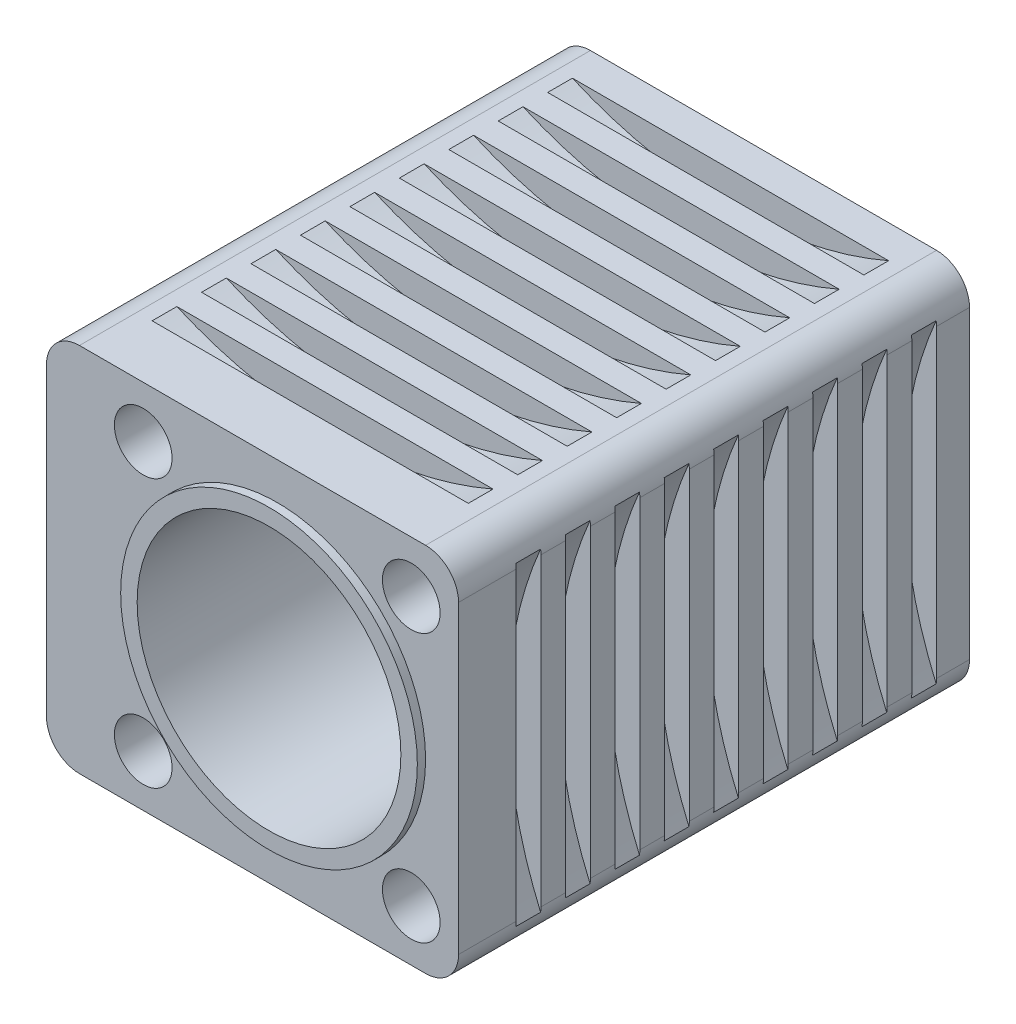
from build123d import *

# Parameters (mm, degrees)
BOSS_EXTRUDE1_DEPTH     = 31
SKETCH2_R               = 18
BOSS_EXTRUDE2_DEPTH     = 1
SKETCH3_R               = 16
CUT_EXTRUDE1_DEPTH      = 73.520686704
CUT_EXTRUDE2_DEPTH      = 2
SKETCH5_R               = 3.5
CUT_EXTRUDE3_DEPTH      = 73.520686704
SKETCH6_W               = 3
SKETCH6_H               = 48
LPATTERN2_COUNT         = 9
LPATTERN2_PITCH         = 6
MIRROR1_COPY_1_SKETCH_W = 3
MIRROR1_COPY_1_SKETCH_H = 48
MIRROR1_COPY_2_SKETCH_W = 3
MIRROR1_COPY_2_SKETCH_H = 48
MIRROR1_COPY_3_SKETCH_W = 3
MIRROR1_COPY_3_SKETCH_H = 48
MIRROR1_COPY_4_SKETCH_W = 3
MIRROR1_COPY_4_SKETCH_H = 48
MIRROR1_COPY_5_SKETCH_W = 3
MIRROR1_COPY_5_SKETCH_H = 48
MIRROR1_COPY_6_SKETCH_W = 3
MIRROR1_COPY_6_SKETCH_H = 48
MIRROR1_COPY_7_SKETCH_W = 3
MIRROR1_COPY_7_SKETCH_H = 48
MIRROR1_COPY_8_SKETCH_W = 3
MIRROR1_COPY_8_SKETCH_H = 48
SKETCH8_W               = 48
SKETCH8_H               = 3
LPATTERN3_COUNT         = 9
LPATTERN3_PITCH         = 6
MIRROR2_COPY_1_SKETCH_W = 48
MIRROR2_COPY_1_SKETCH_H = 3
MIRROR2_COPY_2_SKETCH_W = 48
MIRROR2_COPY_2_SKETCH_H = 3
MIRROR2_COPY_3_SKETCH_W = 48
MIRROR2_COPY_3_SKETCH_H = 3
MIRROR2_COPY_4_SKETCH_W = 48
MIRROR2_COPY_4_SKETCH_H = 3
MIRROR2_COPY_5_SKETCH_W = 48
MIRROR2_COPY_5_SKETCH_H = 3
MIRROR2_COPY_6_SKETCH_W = 48
MIRROR2_COPY_6_SKETCH_H = 3
MIRROR2_COPY_7_SKETCH_W = 48
MIRROR2_COPY_7_SKETCH_H = 3
MIRROR2_COPY_8_SKETCH_W = 48
MIRROR2_COPY_8_SKETCH_H = 3


with BuildPart() as part:
    # Sketch1 → Boss-Extrude1 (new, symmetric)
    with BuildSketch(Plane.XY):
        with BuildLine():
            Line((18, 22.5), (-24, 22.5))
            ThreePointArc((-24, 22.5), (-26.828427125, 21.328427125), (-28, 18.5))
            Line((-28, 18.5), (-28, -18.5))
            ThreePointArc((-28, -18.5), (-26.828427125, -21.328427125), (-24, -22.5))
            Line((-24, -22.5), (18, -22.5))
            ThreePointArc((18, -22.5), (20.828427125, -21.328427125), (22, -18.5))
            Line((22, -18.5), (22, 18.5))
            ThreePointArc((22, 18.5), (20.828427125, 21.328427125), (18, 22.5))
        make_face()
    extrude(amount=BOSS_EXTRUDE1_DEPTH, both=True)

    # Sketch2 → Boss-Extrude2 (add, symmetric)
    with BuildSketch(Plane.XY.offset(31)):
        with Locations(Location((0, 0, 0), (0, 0, 180))):
            Circle(SKETCH2_R)
    extrude(amount=BOSS_EXTRUDE2_DEPTH, both=True)

    # Sketch3 → Cut-Extrude1 (cut, through all)
    with BuildSketch(Plane.XY.offset(32)):
        Circle(SKETCH3_R)
    extrude(amount=-CUT_EXTRUDE1_DEPTH, mode=Mode.SUBTRACT)

    # Sketch4 → Cut-Extrude2 (cut)
    with BuildSketch(Plane(origin=(0, 0, -31), x_dir=(-1, 0, 0), z_dir=(0, 0, -1))):
        with BuildLine():
            Line((12.872380115, 2), (12.872380115, -2))
            Line((12.872380115, -2), (22.61, -2))
            ThreePointArc((22.61, -2), (24.657927917, -0.354015138), (23.490928495, 2))
            Line((23.490928495, 2), (12.872380115, 2))
        make_face()
    extrude(amount=-CUT_EXTRUDE2_DEPTH, mode=Mode.SUBTRACT)

    # Sketch5 → Cut-Extrude3 (cut, through all)
    with BuildSketch(Plane(origin=(0, 0, -31), x_dir=(-1, 0, 0), z_dir=(0, 0, -1))):
        with Locations((-16.263455967, 16.263455967)):
            Circle(SKETCH5_R)
        with Locations((16.263455967, 16.263455967)):
            Circle(SKETCH5_R)
        with Locations((16.263455967, -16.263455967)):
            Circle(SKETCH5_R)
        with Locations((-16.263455967, -16.263455967)):
            Circle(SKETCH5_R)
    extrude(amount=-CUT_EXTRUDE3_DEPTH, mode=Mode.SUBTRACT)

    # Sketch6 → Cut-Revolve1 (revolve, cut)
    with BuildSketch(Plane(origin=(-3, 0, 0), x_dir=(0, 0, -1), z_dir=(1, 0, 0))):
        with Locations((25.5, 42.5)):
            Rectangle(SKETCH6_W, SKETCH6_H)
    cut_revolve1 = revolve(axis=Axis((-3, 66.5, -24), (0, 0, -1)), mode=Mode.SUBTRACT)

    # LPattern2: Cut-Revolve1 ×9
    with Locations(*[(0, 0, i * LPATTERN2_PITCH) for i in range(1, LPATTERN2_COUNT)]):
        add(cut_revolve1, mode=Mode.SUBTRACT)

    # Mirror1: Cut-Revolve1 across plane
    add(cut_revolve1.mirror(Plane.ZX), mode=Mode.SUBTRACT)

    # Mirror1 copy 1 sketch → Mirror1 copy 1 (revolve, cut)
    with BuildSketch(Plane(origin=(-3, 0, 6), x_dir=(0, 0, -1), z_dir=(1, 0, 0))):
        with Locations((25.5, -42.5)):
            Rectangle(MIRROR1_COPY_1_SKETCH_W, MIRROR1_COPY_1_SKETCH_H)
    revolve(axis=Axis((-3, -66.5, -18), (0, 0, 1)), mode=Mode.SUBTRACT)

    # Mirror1 copy 2 sketch → Mirror1 copy 2 (revolve, cut)
    with BuildSketch(Plane(origin=(-3, 0, 12), x_dir=(0, 0, -1), z_dir=(1, 0, 0))):
        with Locations((25.5, -42.5)):
            Rectangle(MIRROR1_COPY_2_SKETCH_W, MIRROR1_COPY_2_SKETCH_H)
    revolve(axis=Axis((-3, -66.5, -12), (0, 0, 1)), mode=Mode.SUBTRACT)

    # Mirror1 copy 3 sketch → Mirror1 copy 3 (revolve, cut)
    with BuildSketch(Plane(origin=(-3, 0, 18), x_dir=(0, 0, -1), z_dir=(1, 0, 0))):
        with Locations((25.5, -42.5)):
            Rectangle(MIRROR1_COPY_3_SKETCH_W, MIRROR1_COPY_3_SKETCH_H)
    revolve(axis=Axis((-3, -66.5, -6), (0, 0, 1)), mode=Mode.SUBTRACT)

    # Mirror1 copy 4 sketch → Mirror1 copy 4 (revolve, cut)
    with BuildSketch(Plane(origin=(-3, 0, 24), x_dir=(0, 0, -1), z_dir=(1, 0, 0))):
        with Locations((25.5, -42.5)):
            Rectangle(MIRROR1_COPY_4_SKETCH_W, MIRROR1_COPY_4_SKETCH_H)
    revolve(axis=Axis((-3, -66.5, 0), (0, 0, 1)), mode=Mode.SUBTRACT)

    # Mirror1 copy 5 sketch → Mirror1 copy 5 (revolve, cut)
    with BuildSketch(Plane(origin=(-3, 0, 30), x_dir=(0, 0, -1), z_dir=(1, 0, 0))):
        with Locations((25.5, -42.5)):
            Rectangle(MIRROR1_COPY_5_SKETCH_W, MIRROR1_COPY_5_SKETCH_H)
    revolve(axis=Axis((-3, -66.5, 6), (0, 0, 1)), mode=Mode.SUBTRACT)

    # Mirror1 copy 6 sketch → Mirror1 copy 6 (revolve, cut)
    with BuildSketch(Plane(origin=(-3, 0, 36), x_dir=(0, 0, -1), z_dir=(1, 0, 0))):
        with Locations((25.5, -42.5)):
            Rectangle(MIRROR1_COPY_6_SKETCH_W, MIRROR1_COPY_6_SKETCH_H)
    revolve(axis=Axis((-3, -66.5, 12), (0, 0, 1)), mode=Mode.SUBTRACT)

    # Mirror1 copy 7 sketch → Mirror1 copy 7 (revolve, cut)
    with BuildSketch(Plane(origin=(-3, 0, 42), x_dir=(0, 0, -1), z_dir=(1, 0, 0))):
        with Locations((25.5, -42.5)):
            Rectangle(MIRROR1_COPY_7_SKETCH_W, MIRROR1_COPY_7_SKETCH_H)
    revolve(axis=Axis((-3, -66.5, 18), (0, 0, 1)), mode=Mode.SUBTRACT)

    # Mirror1 copy 8 sketch → Mirror1 copy 8 (revolve, cut)
    with BuildSketch(Plane(origin=(-3, 0, 48), x_dir=(0, 0, -1), z_dir=(1, 0, 0))):
        with Locations((25.5, -42.5)):
            Rectangle(MIRROR1_COPY_8_SKETCH_W, MIRROR1_COPY_8_SKETCH_H)
    revolve(axis=Axis((-3, -66.5, 24), (0, 0, 1)), mode=Mode.SUBTRACT)

    # Sketch8 → Cut-Revolve2 (revolve, cut)
    with BuildSketch(Plane(origin=(0, 0, 0), x_dir=(1, 0, 0), z_dir=(0, 1, 0))):
        with Locations((-48, 25.5)):
            Rectangle(SKETCH8_W, SKETCH8_H)
    cut_revolve2 = revolve(axis=Axis((-72, 0, -27), (0, 0, 1)), mode=Mode.SUBTRACT)

    # LPattern3: Cut-Revolve2 ×9
    with Locations(*[(0, 0, i * LPATTERN3_PITCH) for i in range(1, LPATTERN3_COUNT)]):
        add(cut_revolve2, mode=Mode.SUBTRACT)

    # Mirror2: Cut-Revolve2 across plane
    add(cut_revolve2.mirror(Plane(origin=(-3, 0, 0), x_dir=(0, 0, 1), z_dir=(1, 0, 0))), mode=Mode.SUBTRACT)

    # Mirror2 copy 1 sketch → Mirror2 copy 1 (revolve, cut)
    with BuildSketch(Plane(origin=(-6, 0, 6), x_dir=(-1, 0, 0), z_dir=(0, 1, 0))):
        with Locations((-48, -25.5)):
            Rectangle(MIRROR2_COPY_1_SKETCH_W, MIRROR2_COPY_1_SKETCH_H)
    revolve(axis=Axis((66, 0, -21), (0, 0, -1)), mode=Mode.SUBTRACT)

    # Mirror2 copy 2 sketch → Mirror2 copy 2 (revolve, cut)
    with BuildSketch(Plane(origin=(-6, 0, 12), x_dir=(-1, 0, 0), z_dir=(0, 1, 0))):
        with Locations((-48, -25.5)):
            Rectangle(MIRROR2_COPY_2_SKETCH_W, MIRROR2_COPY_2_SKETCH_H)
    revolve(axis=Axis((66, 0, -15), (0, 0, -1)), mode=Mode.SUBTRACT)

    # Mirror2 copy 3 sketch → Mirror2 copy 3 (revolve, cut)
    with BuildSketch(Plane(origin=(-6, 0, 18), x_dir=(-1, 0, 0), z_dir=(0, 1, 0))):
        with Locations((-48, -25.5)):
            Rectangle(MIRROR2_COPY_3_SKETCH_W, MIRROR2_COPY_3_SKETCH_H)
    revolve(axis=Axis((66, 0, -9), (0, 0, -1)), mode=Mode.SUBTRACT)

    # Mirror2 copy 4 sketch → Mirror2 copy 4 (revolve, cut)
    with BuildSketch(Plane(origin=(-6, 0, 24), x_dir=(-1, 0, 0), z_dir=(0, 1, 0))):
        with Locations((-48, -25.5)):
            Rectangle(MIRROR2_COPY_4_SKETCH_W, MIRROR2_COPY_4_SKETCH_H)
    revolve(axis=Axis((66, 0, -3), (0, 0, -1)), mode=Mode.SUBTRACT)

    # Mirror2 copy 5 sketch → Mirror2 copy 5 (revolve, cut)
    with BuildSketch(Plane(origin=(-6, 0, 30), x_dir=(-1, 0, 0), z_dir=(0, 1, 0))):
        with Locations((-48, -25.5)):
            Rectangle(MIRROR2_COPY_5_SKETCH_W, MIRROR2_COPY_5_SKETCH_H)
    revolve(axis=Axis((66, 0, 3), (0, 0, -1)), mode=Mode.SUBTRACT)

    # Mirror2 copy 6 sketch → Mirror2 copy 6 (revolve, cut)
    with BuildSketch(Plane(origin=(-6, 0, 36), x_dir=(-1, 0, 0), z_dir=(0, 1, 0))):
        with Locations((-48, -25.5)):
            Rectangle(MIRROR2_COPY_6_SKETCH_W, MIRROR2_COPY_6_SKETCH_H)
    revolve(axis=Axis((66, 0, 9), (0, 0, -1)), mode=Mode.SUBTRACT)

    # Mirror2 copy 7 sketch → Mirror2 copy 7 (revolve, cut)
    with BuildSketch(Plane(origin=(-6, 0, 42), x_dir=(-1, 0, 0), z_dir=(0, 1, 0))):
        with Locations((-48, -25.5)):
            Rectangle(MIRROR2_COPY_7_SKETCH_W, MIRROR2_COPY_7_SKETCH_H)
    revolve(axis=Axis((66, 0, 15), (0, 0, -1)), mode=Mode.SUBTRACT)

    # Mirror2 copy 8 sketch → Mirror2 copy 8 (revolve, cut)
    with BuildSketch(Plane(origin=(-6, 0, 48), x_dir=(-1, 0, 0), z_dir=(0, 1, 0))):
        with Locations((-48, -25.5)):
            Rectangle(MIRROR2_COPY_8_SKETCH_W, MIRROR2_COPY_8_SKETCH_H)
    revolve(axis=Axis((66, 0, 21), (0, 0, -1)), mode=Mode.SUBTRACT)


solid = part.part
